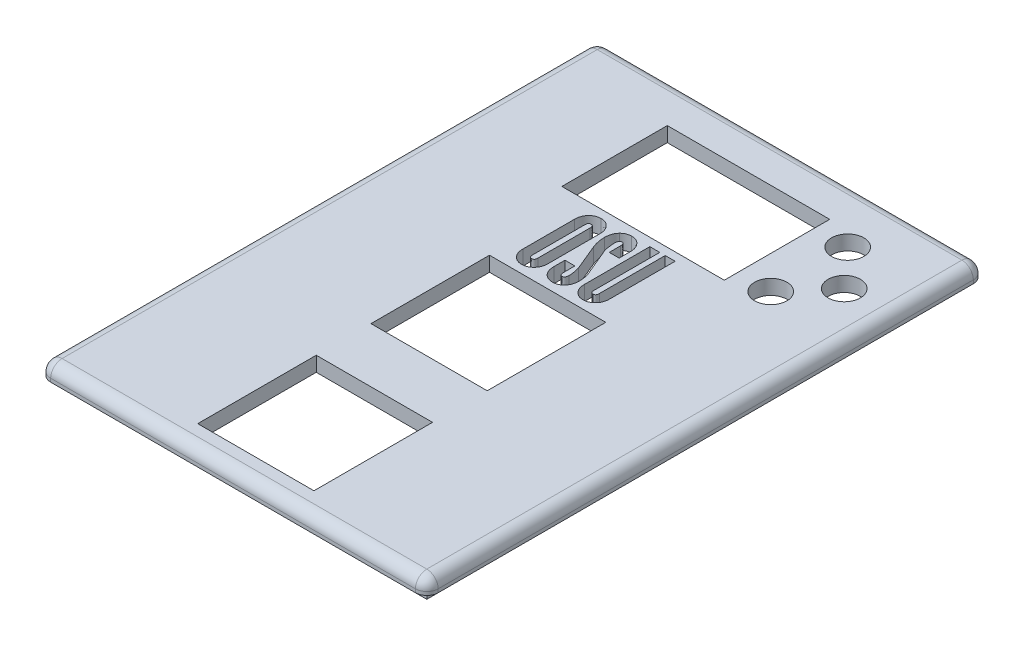
from build123d import *

# Parameters (mm, degrees)
SKETCH1_W           = 86.36
SKETCH1_H           = 124.333
BOSS_EXTRUDE1_DEPTH = 3.302
SKETCH2_W           = 81.28
SKETCH2_H           = 119.253
BOSS_EXTRUDE2_DEPTH = 2.54
CUT_EXTRUDE1_DEPTH  = 2.54
SKETCH6_W           = 25.908
SKETCH6_H           = 26.416
SKETCH6_W_2         = 36.195
SKETCH6_H_2         = 23.495
CUT_EXTRUDE2_DEPTH  = 3.302
FILLET1_R           = 2.54
SKETCH7_R           = 3.6
CUT_EXTRUDE3_DEPTH  = 152.495456872
CUT_EXTRUDE4_DEPTH  = 152.495456872


with BuildPart() as part:
    # Sketch1 → Boss-Extrude1 (new body)
    with BuildSketch(Plane(origin=(0, 0, 0), x_dir=(1, 0, 0), z_dir=(0, 1, 0))):
        with Locations((43.18, 62.1665)):
            Rectangle(SKETCH1_W, SKETCH1_H)
    extrude(amount=BOSS_EXTRUDE1_DEPTH)

    # Sketch2 → Boss-Extrude2 (add)
    with BuildSketch(Plane.XZ):
        with Locations((43.18, -62.1665)):
            Rectangle(SKETCH2_W, SKETCH2_H)
    extrude(amount=BOSS_EXTRUDE2_DEPTH)

    # Sketch4 → Cut-Extrude1 (cut)
    with BuildSketch(Plane.XZ.offset(2.54)):
        Polygon((63.5, -121.793), (63.5, -119.253), (81.28, -119.253), (81.28, -5.08), (63.5, -5.08), (63.5, -2.54), (22.86, -2.54), (22.86, -5.08), (5.08, -5.08), (5.08, -119.253), (22.86, -119.253), (22.86, -121.793), align=None)
    extrude(amount=-CUT_EXTRUDE1_DEPTH, mode=Mode.SUBTRACT)

    # Sketch6 → Cut-Extrude2 (cut)
    with BuildSketch(Plane(origin=(0, 3.302, 0), x_dir=(1, 0, 0), z_dir=(0, 1, 0))):
        with Locations((43.18, 18.288)):
            Rectangle(SKETCH6_W, SKETCH6_H)
        with Locations((43.18, 56.896)):
            Rectangle(SKETCH6_W, SKETCH6_H)
        with Locations((43.1165, 103.1875)):
            Rectangle(SKETCH6_W_2, SKETCH6_H_2)
    extrude(amount=-CUT_EXTRUDE2_DEPTH, mode=Mode.SUBTRACT)

    # Fillet1
    fillet1_edges = [part.edges().sort_by_distance(p)[0] for p in [
        (86.36, 3.302, -62.1665),
        (43.18, 3.302, -124.333),
        (0, 3.302, -62.1665),
        (43.18, 3.302, 0),
        (0, 1.651, -124.333),
        (86.36, 1.651, -124.333),
        (86.36, 1.651, 0),
        (0, 1.651, 0),
    ]]
    fillet(fillet1_edges, radius=FILLET1_R)

    # Sketch7 → Cut-Extrude3 (cut, through all)
    with BuildSketch(Plane(origin=(0, 3.302, 0), x_dir=(1, 0, 0), z_dir=(0, 1, 0))):
        with Locations(Location((68.58, 111.578879738, 0), (0, 0, 270))):
            Circle(SKETCH7_R)
        with Locations(Location((76.2, 103.1875, 0), (0, 0, 270))):
            Circle(SKETCH7_R)
        with Locations(Location((68.58, 94.433879738, 0), (0, 0, 270))):
            Circle(SKETCH7_R)
    extrude(amount=-CUT_EXTRUDE3_DEPTH, mode=Mode.SUBTRACT)

    # Sketch8 → Cut-Extrude4 (cut, through all)
    # profile 1 of 3: a face of its own
    with BuildSketch(Plane(origin=(0, 3.302, 0), x_dir=(1, 0, 0), z_dir=(0, 1, 0))):
        with BuildLine():
            add(Edge.make_bspline(
                [(38.391774909, 75.001283043), (38.389449226, 74.889010349), (38.384914374, 74.670089742), (38.346795775, 74.348843921), (38.281111738, 74.044622825), (38.189444885, 73.756064416), (38.072788162, 73.484108602), (37.930377149, 73.228208633), (37.76320337, 72.986697757), (37.568520861, 72.767020231), (37.359833923, 72.564836199), (37.134636382, 72.392425326), (36.901616278, 72.241669225), (36.654510044, 72.123449162), (36.398411711, 72.026503092), (36.12984919, 71.962597555), (35.851055326, 71.918852588), (35.661100131, 71.914945484), (35.564479502, 71.912958138)],
                knots=[0, 0, 0, 0, 1.150870775, 2.244083756, 3.310821464, 4.337382004, 5.343654245, 6.339598371, 7.335484497, 8.348621665, 9.344507791, 10.309821871, 11.252061722, 12.184627206, 13.11303345, 14.054107807, 15.01022277, 16, 16, 16, 16], degree=3))
            add(Edge.make_bspline(
                [(35.564479502, 71.912958138), (35.467860624, 71.914948898), (35.277908871, 71.918862714), (34.999089996, 71.962558906), (34.730619976, 72.026644836), (34.475064215, 72.122595001), (34.230026797, 72.242765548), (33.997638957, 72.391267495), (33.775380911, 72.566111514), (33.56666912, 72.765960332), (33.374970609, 72.98681324), (33.211736665, 73.22921524), (33.067744012, 73.483220154), (32.956417071, 73.75695958), (32.862287804, 74.04406601), (32.802212223, 74.349332286), (32.762590865, 74.670016554), (32.758269761, 74.888985539), (32.756053697, 75.001283043)],
                knots=[0, 0, 0, 0, 0.992114445, 1.950487135, 2.893783703, 3.824382242, 4.749476454, 5.693941267, 6.653040364, 7.651278131, 8.659753907, 9.651868352, 10.650164255, 11.654603576, 12.683588189, 13.750617167, 14.846411611, 16, 16, 16, 16], degree=3))
            Line((32.756053697, 75.001283043), (32.756053697, 86.536899899))
            add(Edge.make_bspline(
                [(32.756053697, 86.536899899), (32.758373136, 86.649175007), (32.762895813, 86.868100319), (32.801101529, 87.189312471), (32.866469768, 87.493655617), (32.959135366, 87.781389107), (33.071520604, 88.054555275), (33.21295875, 88.310727788), (33.386285405, 88.546496043), (33.575625558, 88.769371755), (33.78523237, 88.969775896), (34.010234988, 89.143979278), (34.246632787, 89.291723506), (34.492343305, 89.415619023), (34.749563181, 89.511395693), (35.017939529, 89.575662868), (35.296783731, 89.619310055), (35.486731999, 89.623230614), (35.583349104, 89.625224805)],
                knots=[0, 0, 0, 0, 1.150866748, 2.244075904, 3.31080988, 4.337366828, 5.339436392, 6.335377033, 7.328704338, 8.334800835, 9.330683476, 10.29599418, 11.247321121, 12.184640556, 13.113043551, 14.054114615, 15.010226234, 16, 16, 16, 16], degree=3))
            add(Edge.make_bspline(
                [(35.583349104, 89.625224805), (35.679965003, 89.623228096), (35.869910898, 89.619302588), (36.148772339, 89.575691368), (36.417084929, 89.511291172), (36.673659328, 89.416331122), (36.91692678, 89.291571187), (37.150329575, 89.144037884), (37.372374996, 88.968828299), (37.581310164, 88.769194428), (37.77176407, 88.548513151), (37.937081361, 88.308603267), (38.079931919, 88.054857508), (38.191453614, 87.781252378), (38.28552896, 87.494108765), (38.345619681, 87.18885293), (38.385236857, 86.868165779), (38.389558546, 86.649197197), (38.391774909, 86.536899899)],
                knots=[0, 0, 0, 0, 0.992365929, 1.95098155, 2.894517228, 3.825351658, 4.755499656, 5.700203875, 6.659546088, 7.65803689, 8.666768299, 9.650259208, 10.648808162, 11.653502091, 12.682747534, 13.750046986, 14.846119196, 16, 16, 16, 16], degree=3))
            Line((38.391774909, 86.536899899), (38.391774909, 75.001283043))
        make_face()
        with BuildLine():
            Line((36.177741576, 74.9226597), (36.177741576, 86.593508706))
            add(Edge.make_bspline(
                [(36.177741576, 86.593508706), (36.176090885, 86.657531071), (36.172987212, 86.777907626), (36.146364104, 86.94589202), (36.09740083, 87.087000586), (36.037628114, 87.20824359), (35.94779237, 87.297223227), (35.845018175, 87.368065165), (35.718726302, 87.404327918), (35.629654633, 87.408843805), (35.583349104, 87.411191471)],
                knots=[0, 0, 0, 0, 1.336635857, 2.513178339, 3.530565084, 4.451062573, 5.302353795, 6.140032556, 7.033062066, 8, 8, 8, 8], degree=3))
            add(Edge.make_bspline(
                [(35.583349104, 87.411191471), (35.534840767, 87.409149494), (35.443464756, 87.405302986), (35.314549235, 87.366266746), (35.206580385, 87.299658917), (35.117553393, 87.206296987), (35.048839392, 87.089131175), (35.002086, 86.945520705), (34.974650508, 86.778021672), (34.971671447, 86.657570667), (34.970087031, 86.593508706)],
                knots=[0, 0, 0, 0, 0.997799626, 1.879572745, 2.743151987, 3.583712918, 4.513936717, 5.518499582, 6.68021207, 8, 8, 8, 8], degree=3))
            Line((34.970087031, 86.593508706), (34.970087031, 74.9226597))
            add(Edge.make_bspline(
                [(34.970087031, 74.9226597), (34.971720509, 74.86069583), (34.974813183, 74.74337931), (35.002037024, 74.580013176), (35.048850041, 74.439458532), (35.117612885, 74.325395838), (35.20678799, 74.235009505), (35.315448415, 74.172451535), (35.443355034, 74.132676771), (35.534802718, 74.128962989), (35.583349104, 74.126991471)],
                knots=[0, 0, 0, 0, 1.297706526, 2.456954578, 3.457341835, 4.384115695, 5.222885016, 6.089385025, 6.985721137, 8, 8, 8, 8], degree=3))
            add(Edge.make_bspline(
                [(35.583349104, 74.126991471), (35.62969392, 74.129272309), (35.718841161, 74.133659647), (35.844059763, 74.170649287), (35.947675263, 74.23741516), (36.037508996, 74.323439726), (36.0974378, 74.441616886), (36.146403813, 74.579637813), (36.172830422, 74.743492736), (36.176044156, 74.860735033), (36.177741576, 74.9226597)],
                knots=[0, 0, 0, 0, 0.983233978, 1.891313936, 2.731106387, 3.58086531, 4.497359879, 5.510854266, 6.685290851, 8, 8, 8, 8], degree=3))
        make_face(mode=Mode.SUBTRACT)
    # profile 2 of 3: a face of its own
    with BuildSketch(Plane(origin=(0, 3.302, 0), x_dir=(1, 0, 0), z_dir=(0, 1, 0))):
        with BuildLine():
            Line((45.235150667, 83.989503592), (43.021117334, 83.989503592))
            Line((43.021117334, 83.989503592), (43.021117334, 86.505450562))
            add(Edge.make_bspline(
                [(43.021117334, 86.505450562), (43.019666111, 86.576867772), (43.016963486, 86.709868762), (42.98826837, 86.89570163), (42.943904707, 87.054092976), (42.875940147, 87.184150659), (42.791590324, 87.289068733), (42.681860262, 87.359419101), (42.556285704, 87.40678939), (42.464937011, 87.409682462), (42.417290061, 87.411191471)],
                knots=[0, 0, 0, 0, 1.388101938, 2.585076231, 3.649644369, 4.570966944, 5.424816129, 6.233641139, 7.078677425, 8, 8, 8, 8], degree=3))
            add(Edge.make_bspline(
                [(42.417290061, 87.411191471), (42.369764972, 87.408216213), (42.278745701, 87.402518047), (42.150577091, 87.357465785), (42.044046377, 87.27862537), (41.956533673, 87.170573863), (41.891884896, 87.032202012), (41.845338535, 86.865492528), (41.818077881, 86.669870348), (41.815064358, 86.529652145), (41.813462788, 86.455131623)],
                knots=[0, 0, 0, 0, 0.89250042, 1.709302145, 2.513640202, 3.354122243, 4.297420952, 5.364241039, 6.599196598, 8, 8, 8, 8], degree=3))
            add(Edge.make_bspline(
                [(41.813462788, 86.455131623), (41.817626362, 86.273660016), (41.82630629, 85.895340694), (41.883394934, 85.304374173), (41.973642486, 84.667162893), (42.060766022, 84.229185108), (42.105941623, 84.002083327)],
                knots=[0, 0, 0, 0, 0.880068233, 1.834704745, 2.87724349, 4, 4, 4, 4], degree=3))
            Line((42.105941623, 84.002083327), (44.452062173, 78.375796916))
            add(Edge.make_bspline(
                [(44.452062173, 78.375796916), (44.513948468, 78.238940904), (44.635755618, 77.969575274), (44.797256319, 77.563095612), (44.931591779, 77.16176172), (45.043850518, 76.765464098), (45.128113114, 76.374559448), (45.187571556, 75.988035724), (45.227835462, 75.608055178), (45.23272939, 75.355710853), (45.235150667, 75.230863204)],
                knots=[0, 0, 0, 0, 1.103280862, 2.171522759, 3.211379636, 4.211021544, 5.195840725, 6.146682417, 7.083068966, 8, 8, 8, 8], degree=3))
            add(Edge.make_bspline(
                [(45.235150667, 75.230863204), (45.233035089, 75.099729441), (45.22891135, 74.844120146), (45.188310099, 74.472466808), (45.117229384, 74.125211843), (45.028588825, 73.797065768), (44.904916256, 73.493293163), (44.757663179, 73.210450316), (44.579483705, 72.952994519), (44.442148745, 72.798500732), (44.37343883, 72.721206102)],
                knots=[0, 0, 0, 0, 1.156361606, 2.25400971, 3.291229419, 4.280611747, 5.247266713, 6.177873313, 7.088373634, 8, 8, 8, 8], degree=3))
            add(Edge.make_bspline(
                [(44.37343883, 72.721206102), (44.308875817, 72.656615902), (44.180785964, 72.52847211), (43.964317662, 72.367622469), (43.741911736, 72.22273403), (43.503328103, 72.109857429), (43.254542677, 72.021678303), (42.993310565, 71.958183806), (42.720338617, 71.920055185), (42.533774374, 71.915343815), (42.439304597, 71.912958138)],
                knots=[0, 0, 0, 0, 1.014595917, 2.012908598, 2.993212371, 3.963405696, 4.940861257, 5.925180132, 6.949381904, 8, 8, 8, 8], degree=3))
            add(Edge.make_bspline(
                [(42.439304597, 71.912958138), (42.345845752, 71.915193828), (42.161295399, 71.919608578), (41.890185191, 71.960142807), (41.627511033, 72.016617313), (41.377596958, 72.108753962), (41.134835007, 72.216593371), (40.904240884, 72.353223762), (40.684869057, 72.515500075), (40.549194014, 72.639239542), (40.480010894, 72.7023365)],
                knots=[0, 0, 0, 0, 1.034024809, 2.041857499, 3.03011876, 4.002924071, 4.984620557, 5.967962345, 6.963827817, 8, 8, 8, 8], degree=3))
            add(Edge.make_bspline(
                [(40.480010894, 72.7023365), (40.408656369, 72.778150821), (40.267029617, 72.928629519), (40.092648885, 73.186062195), (39.93602106, 73.454027061), (39.814700019, 73.744663551), (39.714280258, 74.049949627), (39.652990962, 74.375810049), (39.604025054, 74.716778285), (39.600984803, 74.95076657), (39.599429455, 75.070471585)],
                knots=[0, 0, 0, 0, 0.961843818, 1.909098464, 2.869228767, 3.829604045, 4.817413096, 5.837095117, 6.893489218, 8, 8, 8, 8], degree=3))
            Line((39.599429455, 75.070471585), (39.599429455, 77.54867935))
            Line((39.599429455, 77.54867935), (41.813462788, 77.54867935))
            Line((41.813462788, 77.54867935), (41.813462788, 75.03273238))
            add(Edge.make_bspline(
                [(41.813462788, 75.03273238), (41.815117383, 74.962412335), (41.818244387, 74.829515054), (41.845060984, 74.644139591), (41.892521668, 74.48610804), (41.956364797, 74.354335852), (42.045319357, 74.252986951), (42.150821901, 74.177095083), (42.279368205, 74.13653053), (42.369860975, 74.130271799), (42.417290061, 74.126991471)],
                knots=[0, 0, 0, 0, 1.369486159, 2.588180739, 3.63457484, 4.575208708, 5.414651828, 6.236018696, 7.075461816, 8, 8, 8, 8], degree=3))
            add(Edge.make_bspline(
                [(42.417290061, 74.126991471), (42.46481515, 74.12996673), (42.555834421, 74.135664895), (42.684003031, 74.180717158), (42.790533745, 74.259557572), (42.878046448, 74.367609079), (42.942695225, 74.50598093), (42.989241586, 74.672690414), (43.01650224, 74.868312595), (43.019515763, 75.008530797), (43.021117334, 75.08305132)],
                knots=[0, 0, 0, 0, 0.89250042, 1.709302145, 2.513640202, 3.354122243, 4.297420952, 5.364241039, 6.599196598, 8, 8, 8, 8], degree=3))
            add(Edge.make_bspline(
                [(43.021117334, 75.08305132), (43.016164749, 75.272004174), (43.005890066, 75.664007672), (42.920560185, 76.271306939), (42.790207369, 76.918891528), (42.664697039, 77.358663878), (42.599696216, 77.586418555)],
                knots=[0, 0, 0, 0, 0.889898999, 1.846193441, 2.884560347, 4, 4, 4, 4], degree=3))
            Line((42.599696216, 77.586418555), (40.250430733, 83.222139767))
            add(Edge.make_bspline(
                [(40.250430733, 83.222139767), (40.14931035, 83.478133706), (39.95019347, 83.982213228), (39.753745466, 84.761982228), (39.622891519, 85.538662639), (39.607221369, 86.058344805), (39.599429455, 86.316754539)],
                knots=[0, 0, 0, 0, 1.036832852, 2.041635085, 3.02621142, 4, 4, 4, 4], degree=3))
            add(Edge.make_bspline(
                [(39.599429455, 86.316754539), (39.601369934, 86.447918543), (39.605136943, 86.702544371), (39.647858449, 87.072552264), (39.712890541, 87.421073748), (39.805230342, 87.747487378), (39.930614207, 88.049818857), (40.078383424, 88.330168015), (40.249698852, 88.591797676), (40.388776209, 88.744246511), (40.457996358, 88.820121774)],
                knots=[0, 0, 0, 0, 1.159440677, 2.250796961, 3.289000151, 4.292473762, 5.244524641, 6.177609189, 7.09297842, 8, 8, 8, 8], degree=3))
            add(Edge.make_bspline(
                [(40.457996358, 88.820121774), (40.522735023, 88.884470839), (40.650583882, 89.011550299), (40.863278717, 89.175191455), (41.087461062, 89.314850604), (41.324036994, 89.427753513), (41.572370259, 89.517667841), (41.833072225, 89.579102734), (42.105795176, 89.618442784), (42.291354006, 89.622936566), (42.385840724, 89.625224805)],
                knots=[0, 0, 0, 0, 1.017984989, 2.010363043, 2.987727369, 3.961161447, 4.930861155, 5.929839552, 6.945872507, 8, 8, 8, 8], degree=3))
            add(Edge.make_bspline(
                [(42.385840724, 89.625224805), (42.480341998, 89.622969205), (42.666968443, 89.61851472), (42.940260797, 89.578407598), (43.203881612, 89.521441895), (43.453082639, 89.430104421), (43.693522026, 89.321501263), (43.920886557, 89.184814166), (44.136921078, 89.023468707), (44.268732213, 88.899055364), (44.335699625, 88.835846443)],
                knots=[0, 0, 0, 0, 1.048774086, 2.071178214, 3.062420754, 4.038160717, 5.012232511, 5.988527898, 6.978059923, 8, 8, 8, 8], degree=3))
            add(Edge.make_bspline(
                [(44.335699625, 88.835846443), (44.407739672, 88.759816615), (44.551089519, 88.608527649), (44.733776822, 88.354351364), (44.887167349, 88.082299726), (45.018804139, 87.795310932), (45.115579456, 87.487545843), (45.182858339, 87.16289591), (45.230207365, 86.821321544), (45.233477641, 86.587388243), (45.235150667, 86.467711358)],
                knots=[0, 0, 0, 0, 0.965006751, 1.920231542, 2.877069188, 3.841930668, 4.826352141, 5.844512552, 6.89728387, 8, 8, 8, 8], degree=3))
            Line((45.235150667, 86.467711358), (45.235150667, 83.989503592))
        make_face()
    # profile 3 of 3: a face of its own
    with BuildSketch(Plane(origin=(0, 3.302, 0), x_dir=(1, 0, 0), z_dir=(0, 1, 0))):
        with BuildLine():
            add(Edge.make_bspline(
                [(52.078526424, 75.051601983), (52.076094857, 74.938292472), (52.07130786, 74.715221414), (52.034133621, 74.388642229), (51.96793471, 74.079210477), (51.875478412, 73.786832517), (51.760403716, 73.510023218), (51.617070201, 73.250337546), (51.450065482, 73.005629512), (51.255315426, 72.782822682), (51.046649589, 72.577550626), (50.821490336, 72.401872094), (50.588393071, 72.248345226), (50.342111292, 72.125735977), (50.084558573, 72.030826018), (49.817155583, 71.961496141), (49.537728237, 71.919151284), (49.347825144, 71.915046191), (49.251231017, 71.912958138)],
                knots=[0, 0, 0, 0, 1.151754111, 2.267444333, 3.335547789, 4.363555893, 5.38090272, 6.377724591, 7.373919619, 8.386510763, 9.381336764, 10.345022318, 11.285022955, 12.214391478, 13.134919195, 14.070620796, 15.018622095, 16, 16, 16, 16], degree=3))
            add(Edge.make_bspline(
                [(49.251231017, 71.912958138), (49.154638706, 71.915049657), (48.964739183, 71.919161562), (48.685285872, 71.961456865), (48.417979082, 72.030970341), (48.160953637, 72.124882435), (47.916773829, 72.249454033), (47.684266952, 72.400707701), (47.462089692, 72.578830315), (47.253360627, 72.7817622), (47.061616227, 73.005748672), (46.89855374, 73.251335228), (46.753625537, 73.509150852), (46.643891561, 73.787710085), (46.548970267, 74.078661706), (46.488405041, 74.389131222), (46.449698275, 74.715148625), (46.445127135, 74.938267953), (46.442805212, 75.051601983)],
                knots=[0, 0, 0, 0, 0.983655955, 1.933857829, 2.871731453, 3.79439597, 4.716380079, 5.658562719, 6.616121104, 7.613256372, 8.621260386, 9.613750455, 10.612886225, 11.62850218, 12.658896576, 13.7272923, 14.845572348, 16, 16, 16, 16], degree=3))
            Line((46.442805212, 75.051601983), (46.442805212, 89.625224805))
            Line((46.442805212, 89.625224805), (48.656838546, 89.625224805))
            Line((48.656838546, 89.625224805), (48.656838546, 74.935239435))
            add(Edge.make_bspline(
                [(48.656838546, 74.935239435), (48.658315949, 74.872184323), (48.661091184, 74.753738178), (48.690104867, 74.587856888), (48.733846761, 74.443945798), (48.805548223, 74.328591526), (48.892313635, 74.234853896), (49.002358418, 74.172599281), (49.130060155, 74.132633522), (49.221538145, 74.128947991), (49.27010062, 74.126991471)],
                knots=[0, 0, 0, 0, 1.306709686, 2.45459439, 3.486350212, 4.404039517, 5.250107251, 6.108113529, 6.995663447, 8, 8, 8, 8], degree=3))
            add(Edge.make_bspline(
                [(49.27010062, 74.126991471), (49.316460748, 74.129257955), (49.405637445, 74.133617684), (49.53065313, 74.170797528), (49.635612053, 74.237305997), (49.723117454, 74.326605237), (49.785842719, 74.446162171), (49.831844676, 74.58747755), (49.860053011, 74.75385325), (49.862950569, 74.8722243), (49.864493091, 74.935239435)],
                knots=[0, 0, 0, 0, 0.973470957, 1.872534136, 2.703987869, 3.561030759, 4.468424996, 5.513564712, 6.67633973, 8, 8, 8, 8], degree=3))
            Line((49.864493091, 74.935239435), (49.864493091, 89.625224805))
            Line((49.864493091, 89.625224805), (52.078526424, 89.625224805))
            Line((52.078526424, 89.625224805), (52.078526424, 75.051601983))
        make_face()
    extrude(amount=-CUT_EXTRUDE4_DEPTH, mode=Mode.SUBTRACT)


with BuildPart() as cut_extrude4_piece_1:
    # of the separate pieces the step leaves, piece 1, a body of its own (cut_extrude4_pieces)
    add(part.part.solids().sort_by_distance((2.54, 0, 0))[0])


with BuildPart() as cut_extrude4_piece_2:
    # of the separate pieces the step leaves, piece 2, a body of its own (cut_extrude4_pieces)
    add(part.part.solids().sort_by_distance((36.177741576, 0, -74.9226597))[0])


solid = Compound([cut_extrude4_piece_1.part, cut_extrude4_piece_2.part])
